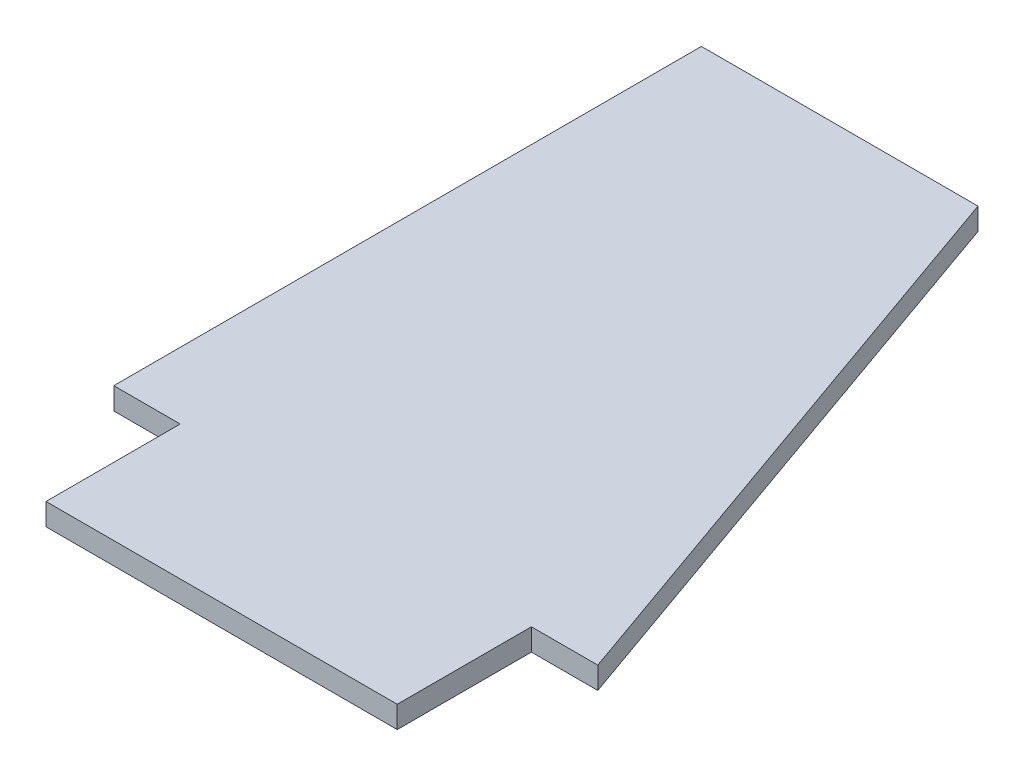
from build123d import *

# Parameters (mm, degrees)
SKETCH1_W           = 50.8
SKETCH1_H           = 19.4056
BOSS_EXTRUDE1_DEPTH = 3.175


with BuildPart() as part:
    # Sketch1 → Boss-Extrude1 (new body)
    with BuildSketch(Plane(origin=(0, 0, 0), x_dir=(1, 0, 0), z_dir=(0, 1, 0))):
        with Locations((35.0012, -9.7028)):
            Rectangle(SKETCH1_W, SKETCH1_H)
        Polygon((70.0024, 0), (0, 0), (0, 84.9884), (40.005, 84.9884), align=None)
    extrude(amount=BOSS_EXTRUDE1_DEPTH)


solid = part.part
